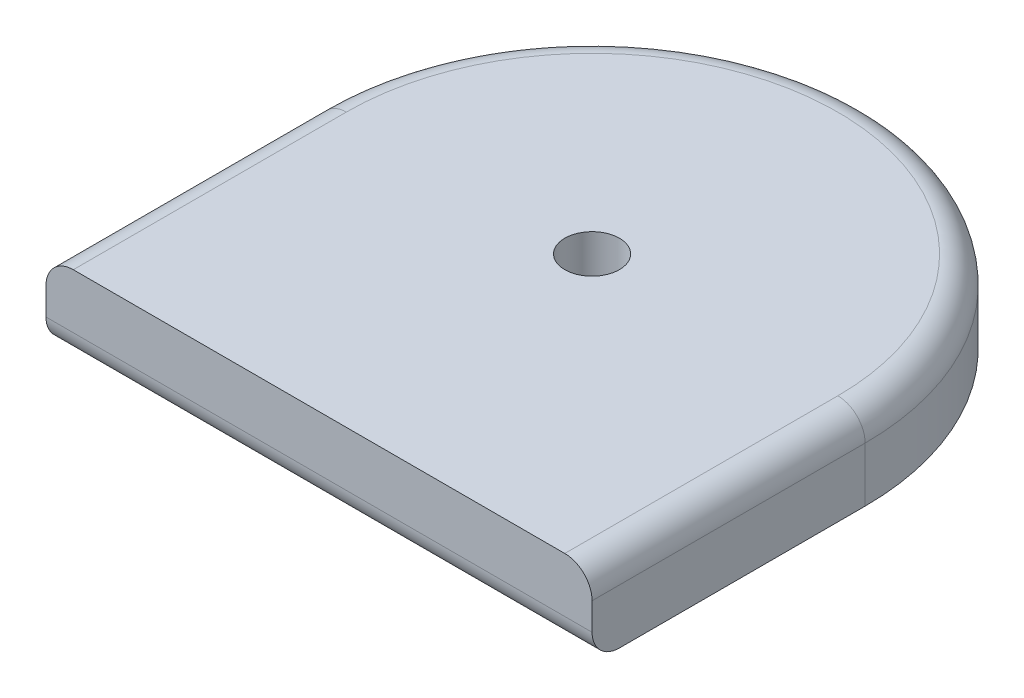
from build123d import *

# Parameters (mm, degrees)
BOSS_EXTRUDE1_DEPTH = 3
SKETCH2_R           = 1
CUT_EXTRUDE1_DEPTH  = 15.456832295
FILLET1_R           = 1


with BuildPart() as part:
    # Sketch1 → Boss-Extrude1 (new body)
    with BuildSketch(Plane(origin=(0, 0, 0), x_dir=(1, 0, 0), z_dir=(0, 1, 0))):
        with BuildLine():
            Line((-10, 0), (-10, -10))
            Line((-10, -10), (10, -10))
            Line((10, -10), (10, 0))
            ThreePointArc((10, 0), (0, 10), (-10, 0))
        make_face()
    extrude(amount=BOSS_EXTRUDE1_DEPTH)

    # Sketch2 → Cut-Extrude1 (cut, through all)
    with BuildSketch(Plane(origin=(0, 3, 0), x_dir=(1, 0, 0), z_dir=(0, 1, 0))):
        with Locations(Location((0, 0, 0), (0, 0, 270))):
            Circle(SKETCH2_R)
    extrude(amount=-CUT_EXTRUDE1_DEPTH, mode=Mode.SUBTRACT)

    # Fillet1
    fillet1_edges = [part.edges().sort_by_distance(p)[0] for p in [
        (10, 3, 5),
        (0, 3, -10),
        (0, 0, 10),
        (-10, 3, 5),
    ]]
    fillet(fillet1_edges, radius=FILLET1_R)


solid = part.part
